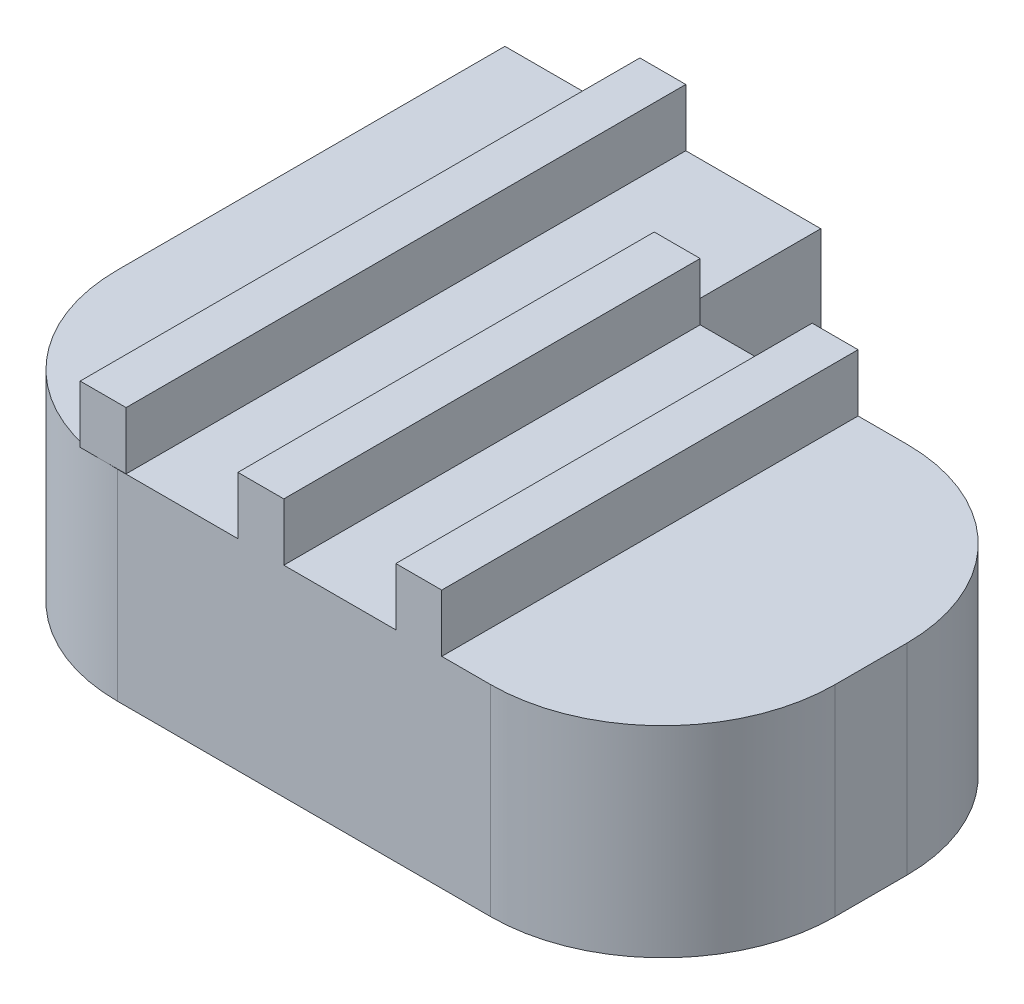
from build123d import *

# Parameters (mm, degrees)
SKETCH_1_W      = 12.5
SKETCH_1_H      = 7.25
EXTRUDE_1_DEPTH = 3.5
FILLET_1_R      = 3
SKETCH_2_W      = 5.5
SKETCH_2_H      = 2.5
EXTRUDE_2_DEPTH = 3.5
SKETCH_3_W      = 0.8
SKETCH_3_H      = 9.746247653
SKETCH_3_H_2    = 7.25
EXTRUDE_3_DEPTH = 1
EXTRUDE_4_DEPTH = 1


with BuildPart() as part:
    # 草图1 → 凸台-拉伸1 (new body)
    with BuildSketch(Plane(origin=(0, 0, 0), x_dir=(1, 0, 0), z_dir=(0, 1, 0))):
        with Locations((6.25, 3.625)):
            Rectangle(SKETCH_1_W, SKETCH_1_H)
    extrude(amount=EXTRUDE_1_DEPTH)

    # 圆角1
    fillet_1_edges = [part.edges().sort_by_distance(p)[0] for p in [
        (12.5, 1.75, -7.25),
        (12.5, 1.75, 0),
        (0, 1.75, 0),
    ]]
    fillet(fillet_1_edges, radius=FILLET_1_R)

    # 草图2 → 凸台-拉伸2 (add)
    with BuildSketch(Plane(origin=(0, 3.5, 0), x_dir=(1, 0, 0), z_dir=(0, 1, 0))):
        with Locations((2.75, 8.5)):
            Rectangle(SKETCH_2_W, SKETCH_2_H)
    extrude(amount=-EXTRUDE_2_DEPTH)

    # 草图3 → 凸台-拉伸3 (add)
    with BuildSketch(Plane(origin=(0, 3.5, 0), x_dir=(1, 0, 0), z_dir=(0, 1, 0))):
        with Locations((2.75, 4.876876174)):
            Rectangle(SKETCH_3_W, SKETCH_3_H)
        with Locations((5.5, 3.625)):
            Rectangle(SKETCH_3_W, SKETCH_3_H_2)
        with Locations((8.25, 3.625)):
            Rectangle(SKETCH_3_W, SKETCH_3_H_2)
    extrude(amount=EXTRUDE_3_DEPTH)

    # 草图6 → 凸台-拉伸4 (add)
    with BuildSketch(Plane.XZ):
        with BuildLine():
            Line((6.365, -4.75), (6.365, -5.25))
            ThreePointArc((6.365, -5.25), (6.865, -5.75), (7.365, -5.25))
            Line((7.365, -5.25), (7.365, -4.75))
            ThreePointArc((7.365, -4.75), (6.865, -4.25), (6.365, -4.75))
        make_face()
        with BuildLine():
            Line((9.115, -4.75), (9.115, -5.25))
            ThreePointArc((9.115, -5.25), (9.615, -5.75), (10.115, -5.25))
            Line((10.115, -5.25), (10.115, -4.75))
            ThreePointArc((10.115, -4.75), (9.615, -4.25), (9.115, -4.75))
        make_face()
        with BuildLine():
            Line((4.615, -5.25), (4.615, -4.75))
            ThreePointArc((4.615, -4.75), (4.115, -4.25), (3.615, -4.75))
            Line((3.615, -4.75), (3.615, -5.25))
            ThreePointArc((3.615, -5.25), (4.115, -5.75), (4.615, -5.25))
        make_face()
        with BuildLine():
            Line((0.865, -4.75), (0.865, -5.25))
            ThreePointArc((0.865, -5.25), (1.365, -5.75), (1.865, -5.25))
            Line((1.865, -5.25), (1.865, -4.75))
            ThreePointArc((1.865, -4.75), (1.365, -4.25), (0.865, -4.75))
        make_face()
    extrude(amount=EXTRUDE_4_DEPTH)


solid = part.part
